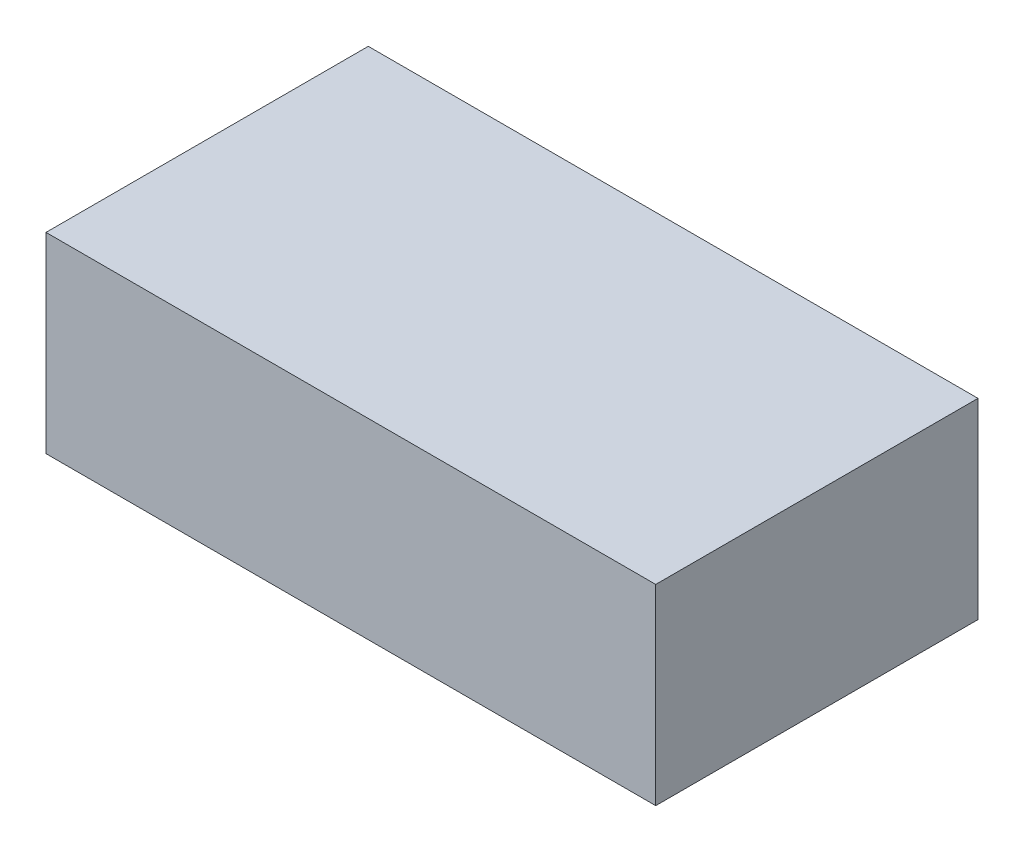
from build123d import *

# Parameters (mm, degrees)
SKETCH1_W           = 70
SKETCH1_H           = 37
BOSS_EXTRUDE1_DEPTH = 22


with BuildPart() as part:
    # Sketch1 → Boss-Extrude1 (new body)
    with BuildSketch(Plane(origin=(0, 0, 0), x_dir=(1, 0, 0), z_dir=(0, 1, 0))):
        Rectangle(SKETCH1_W, SKETCH1_H)
    extrude(amount=BOSS_EXTRUDE1_DEPTH)


solid = part.part
